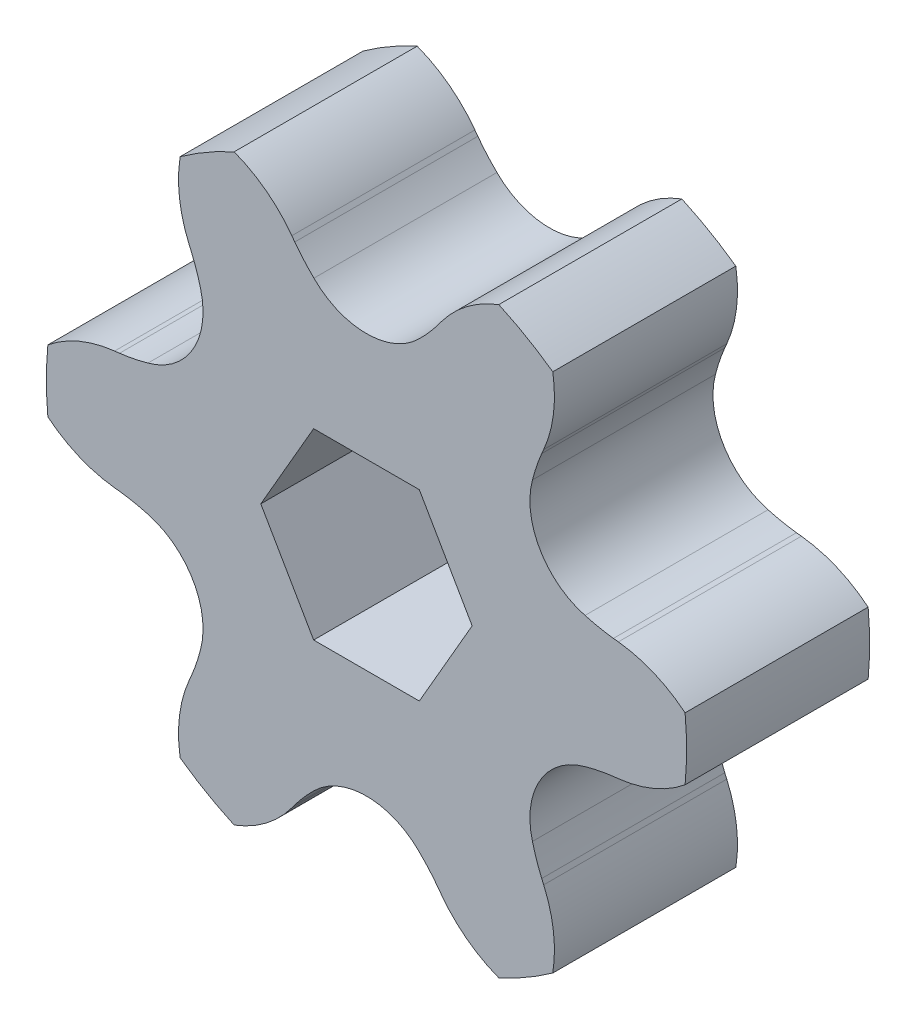
from build123d import *

# Parameters (mm, degrees)
BOSS_EXTRUDE1_DEPTH = 6.35
CUT_EXTRUDE1_DEPTH  = 17.308131721


with BuildPart() as part:
    # Sketch1 → Boss-Extrude1 (new body)
    with BuildSketch(Plane.XY.offset(4.2926)):
        with BuildLine():
            Line((-6.148414016, 6.539673115), (-6.079307951, 6.381995928))
            ThreePointArc((-6.079307951, 6.381995928), (-5.900367293, 5.91212738), (-5.757411872, 5.43009008))
            ThreePointArc((-5.757411872, 5.43009008), (-6.015092025, 3.472815), (-7.581301891, 2.271019901))
            ThreePointArc((-7.581301891, 2.271019901), (-8.070236148, 2.153804277), (-8.566624576, 2.073837159))
            Line((-8.566624576, 2.073837159), (-8.737730058, 2.054846173))
            ThreePointArc((-8.737730058, 2.054846173), (-9.966107592, 1.73564362), (-11.053625442, 1.081345092))
            ThreePointArc((-11.053625442, 1.081345092), (-11.106391971, 0), (-11.053625442, -1.081345092))
            ThreePointArc((-11.053625442, -1.081345092), (-9.966107592, -1.73564362), (-8.737730058, -2.054846173))
            Line((-8.737730058, -2.054846173), (-8.566624576, -2.073837159))
            ThreePointArc((-8.566624576, -2.073837159), (-8.070236148, -2.153804277), (-7.581301891, -2.271019901))
            ThreePointArc((-7.581301891, -2.271019901), (-6.015092025, -3.472815), (-5.757411872, -5.43009008))
            ThreePointArc((-5.757411872, -5.43009008), (-5.900367293, -5.91212738), (-6.079307951, -6.381995928))
            Line((-6.079307951, -6.381995928), (-6.148414016, -6.539673115))
            ThreePointArc((-6.148414016, -6.539673115), (-6.486165263, -7.763080542), (-6.463285041, -9.03204789))
            ThreePointArc((-6.463285041, -9.03204789), (-5.553195986, -9.618417591), (-4.590340401, -10.113392982))
            ThreePointArc((-4.590340401, -10.113392982), (-3.479942329, -9.498724162), (-2.589316042, -8.594519288))
            Line((-2.589316042, -8.594519288), (-2.487316625, -8.455833087))
            ThreePointArc((-2.487316625, -8.455833087), (-2.169868855, -8.065931658), (-1.823890018, -7.701109982))
            ThreePointArc((-1.823890018, -7.701109982), (0, -6.94563), (1.823890018, -7.701109982))
            ThreePointArc((1.823890018, -7.701109982), (2.169868855, -8.065931658), (2.487316625, -8.455833087))
            Line((2.487316625, -8.455833087), (2.589316042, -8.594519288))
            ThreePointArc((2.589316042, -8.594519288), (3.479942329, -9.498724162), (4.590340401, -10.113392982))
            ThreePointArc((4.590340401, -10.113392982), (5.553195986, -9.618417591), (6.463285041, -9.03204789))
            ThreePointArc((6.463285041, -9.03204789), (6.486165263, -7.763080542), (6.148414016, -6.539673115))
            Line((6.148414016, -6.539673115), (6.079307951, -6.381995928))
            ThreePointArc((6.079307951, -6.381995928), (5.900367293, -5.91212738), (5.757411872, -5.43009008))
            ThreePointArc((5.757411872, -5.43009008), (6.015092025, -3.472815), (7.581301891, -2.271019901))
            ThreePointArc((7.581301891, -2.271019901), (8.070236148, -2.153804277), (8.566624576, -2.073837159))
            Line((8.566624576, -2.073837159), (8.737730058, -2.054846173))
            ThreePointArc((8.737730058, -2.054846173), (9.966107592, -1.73564362), (11.053625442, -1.081345092))
            ThreePointArc((11.053625442, -1.081345092), (11.106391971, 0), (11.053625442, 1.081345092))
            ThreePointArc((11.053625442, 1.081345092), (9.966107592, 1.73564362), (8.737730058, 2.054846173))
            Line((8.737730058, 2.054846173), (8.566624576, 2.073837159))
            ThreePointArc((8.566624576, 2.073837159), (8.070236148, 2.153804277), (7.581301891, 2.271019901))
            ThreePointArc((7.581301891, 2.271019901), (6.015092025, 3.472815), (5.757411872, 5.43009008))
            ThreePointArc((5.757411872, 5.43009008), (5.900367293, 5.91212738), (6.079307951, 6.381995928))
            Line((6.079307951, 6.381995928), (6.148414016, 6.539673115))
            ThreePointArc((6.148414016, 6.539673115), (6.486165263, 7.763080542), (6.463285041, 9.03204789))
            ThreePointArc((6.463285041, 9.03204789), (5.553195986, 9.618417591), (4.590340401, 10.113392982))
            ThreePointArc((4.590340401, 10.113392982), (3.479942329, 9.498724162), (2.589316042, 8.594519288))
            Line((2.589316042, 8.594519288), (2.487316625, 8.455833087))
            ThreePointArc((2.487316625, 8.455833087), (2.169868855, 8.065931658), (1.823890018, 7.701109982))
            ThreePointArc((1.823890018, 7.701109982), (0, 6.94563), (-1.823890018, 7.701109982))
            ThreePointArc((-1.823890018, 7.701109982), (-2.169868855, 8.065931658), (-2.487316625, 8.455833087))
            Line((-2.487316625, 8.455833087), (-2.589316042, 8.594519288))
            ThreePointArc((-2.589316042, 8.594519288), (-3.479942329, 9.498724162), (-4.590340401, 10.113392982))
            ThreePointArc((-4.590340401, 10.113392982), (-5.553195986, 9.618417591), (-6.463285041, 9.03204789))
            ThreePointArc((-6.463285041, 9.03204789), (-6.486165263, 7.763080542), (-6.148414016, 6.539673115))
        make_face()
    extrude(amount=-BOSS_EXTRUDE1_DEPTH)

    # Sketch2 → Cut-Extrude1 (cut, through all)
    with BuildSketch(Plane.XY.offset(4.2926)):
        Polygon((3.666174209, 0), (1.833087105, 3.175), (-1.833087105, 3.175), (-3.666174209, 0), (-1.833087105, -3.175), (1.833087105, -3.175), align=None)
    extrude(amount=-CUT_EXTRUDE1_DEPTH, mode=Mode.SUBTRACT)


solid = part.part
